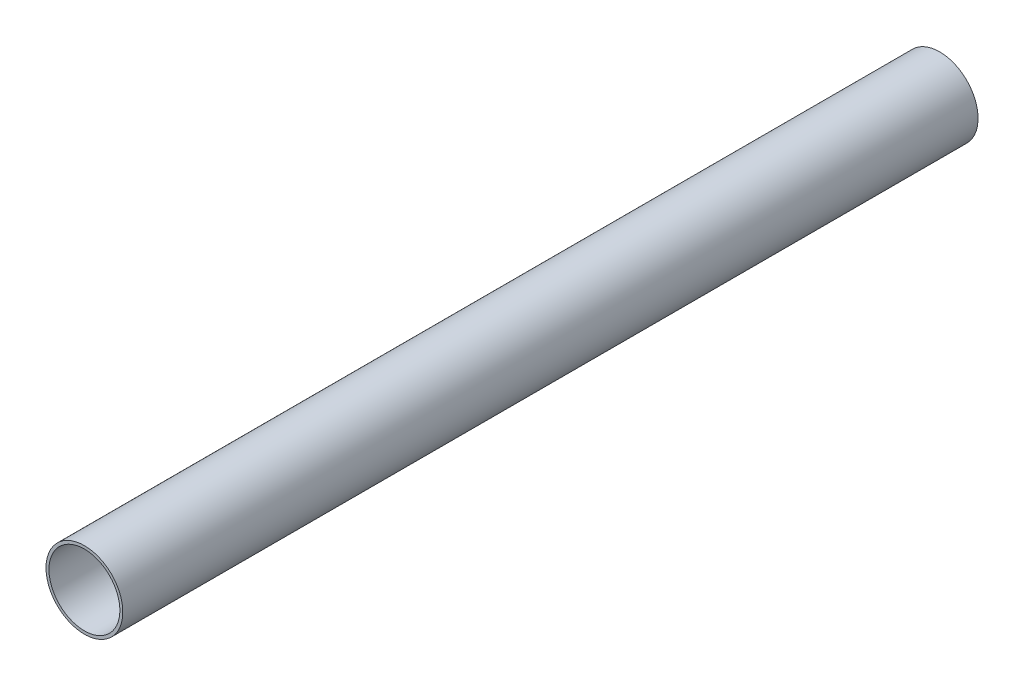
from build123d import *

# Parameters (mm, degrees)
CARDBOARD_MOTOR_TUBE_SKETCH_R      = 20.6375
CARDBOARD_MOTOR_TUBE_SKETCH_R_2    = 19.05
CARDBOARD_MOTOR_TUBE_EXTRUDE_DEPTH = 609.6


with BuildPart() as part:
    # Cardboard Motor Tube Sketch → Cardboard Motor Tube Extrude (new body)
    with BuildSketch(Plane.XY):
        with Locations(Location((0, 0, 0), (0, 0, 180))):
            Circle(CARDBOARD_MOTOR_TUBE_SKETCH_R)
        with Locations(Location((0, 0, 0), (0, 0, 180))):
            Circle(CARDBOARD_MOTOR_TUBE_SKETCH_R_2, mode=Mode.SUBTRACT)
    extrude(amount=CARDBOARD_MOTOR_TUBE_EXTRUDE_DEPTH)

    # Cardboard Motor Tube Surface Cut
    split(bisect_by=Plane.XY.offset(459.600000026), keep=Keep.BOTTOM)


solid = part.part
